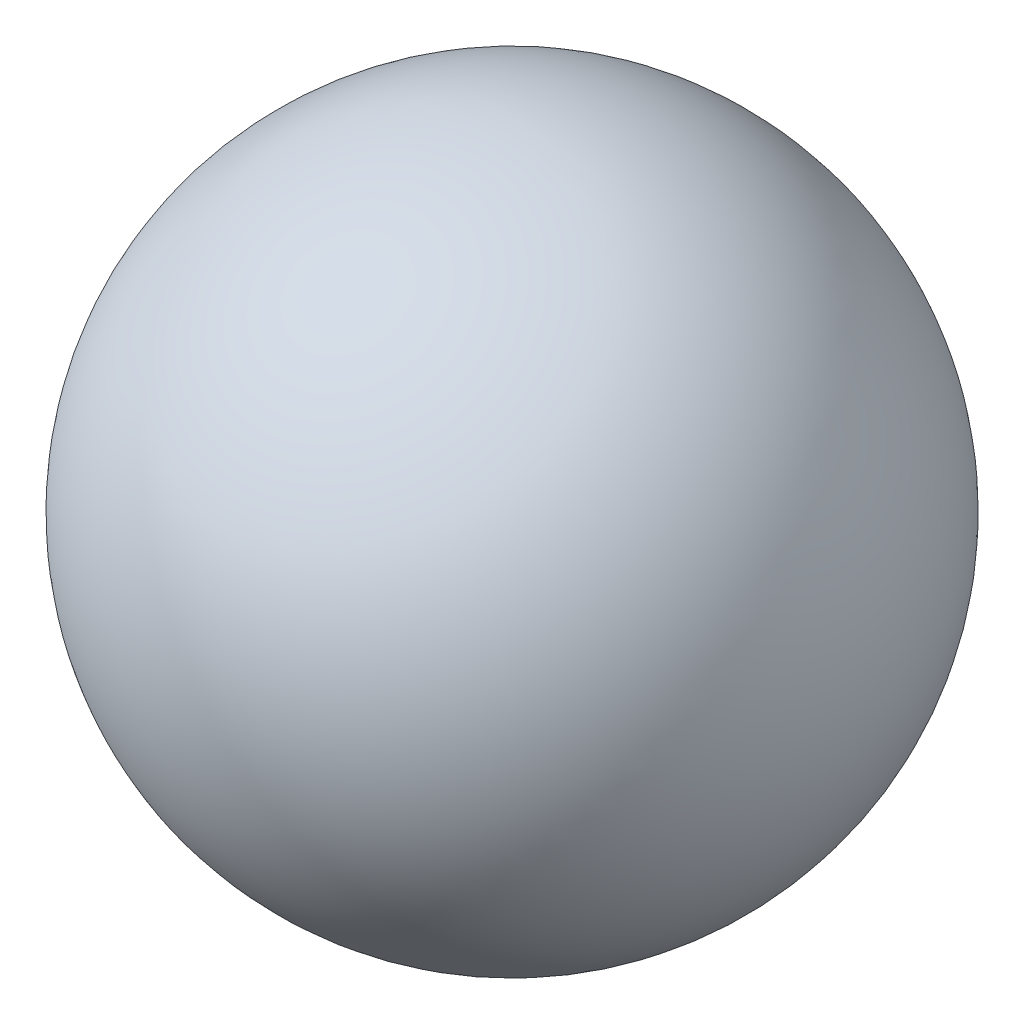
from build123d import *


with BuildPart() as part:
    # Sketch1 → Revolve1 (revolve)
    with BuildSketch(Plane(origin=(0, 0, 0), x_dir=(1, 0, 0), z_dir=(0, 1, 0))):
        with BuildLine():
            Line((0, 6.35), (0, -6.35))
            ThreePointArc((0, -6.35), (6.35, 0), (0, 6.35))
        make_face()
    revolve(axis=Axis((0, 0, 15.134316621), (0, 0, -1)))


solid = part.part
